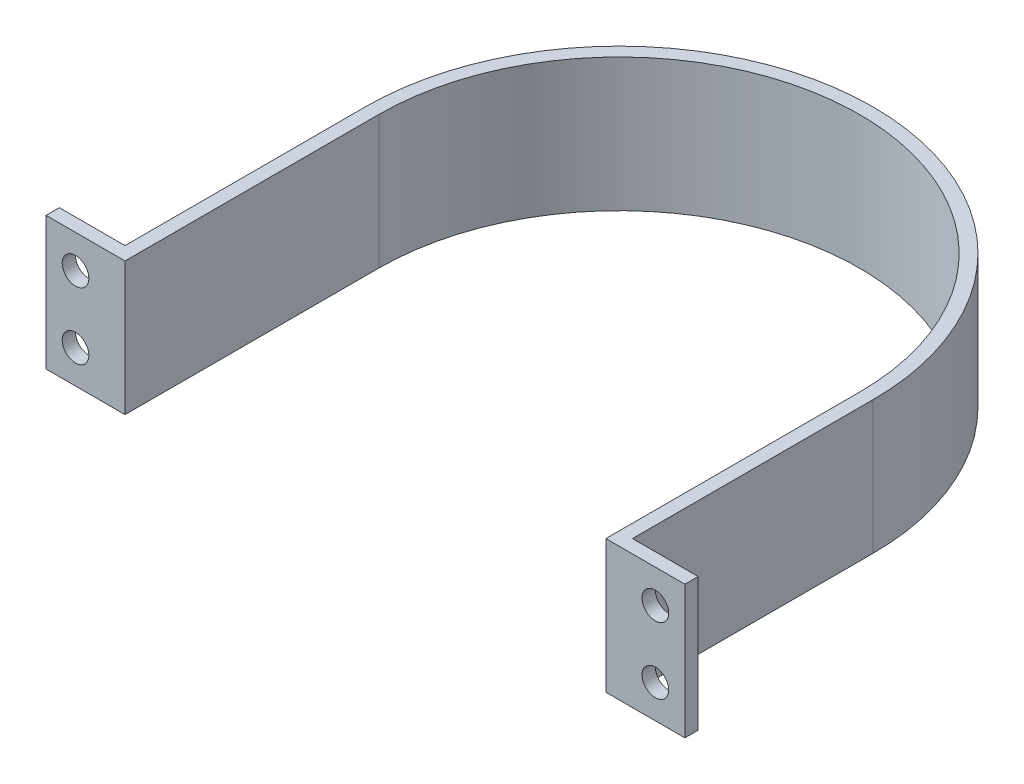
from build123d import *

# Parameters (mm, degrees)
BOSS_EXTRUDE1_DEPTH = 31.75
SKETCH15_R          = 6.35
CUT_EXTRUDE1_DEPTH  = 288.83021471


with BuildPart() as part:
    # Sketch1 → Boss-Extrude1 (new, symmetric)
    with BuildSketch(Plane(origin=(0, 0, 0), x_dir=(1, 0, 0), z_dir=(0, 1, 0))):
        with BuildLine():
            Line((-114.7, -121.05), (-114.7, 0))
            ThreePointArc((-114.7, 0), (0, 114.7), (114.7, 0))
            Line((114.7, 0), (114.7, -121.05))
            Line((114.7, -121.05), (152.4, -121.05))
            Line((152.4, -121.05), (152.4, -114.7))
            Line((152.4, -114.7), (121.05, -114.7))
            Line((121.05, -114.7), (121.05, 0))
            ThreePointArc((121.05, 0), (0, 121.05), (-121.05, 0))
            Line((-121.05, 0), (-121.05, -12.7))
            Line((-121.05, -12.7), (-121.05, -114.7))
            Line((-121.05, -114.7), (-152.4, -114.7))
            Line((-152.4, -114.7), (-152.4, -121.05))
            Line((-152.4, -121.05), (-114.7, -121.05))
        make_face()
    extrude(amount=BOSS_EXTRUDE1_DEPTH, both=True)

    # Sketch15 → Cut-Extrude1 (cut, through all)
    with BuildSketch(Plane.XY.offset(121.05)):
        with Locations((-138.3125, 15.875)):
            Circle(SKETCH15_R)
        with Locations((-138.3125, -15.875)):
            Circle(SKETCH15_R)
        with Locations((138.3125, -15.875)):
            Circle(SKETCH15_R)
        with Locations((138.3125, 15.875)):
            Circle(SKETCH15_R)
    extrude(amount=-CUT_EXTRUDE1_DEPTH, mode=Mode.SUBTRACT)


solid = part.part
